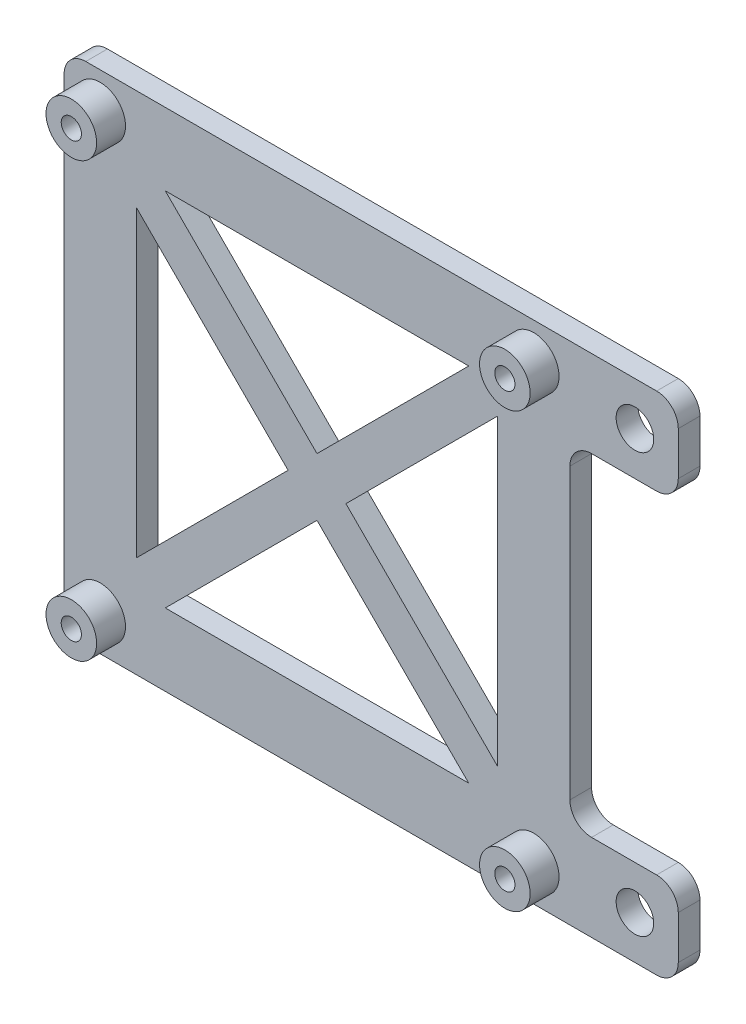
from build123d import *

# Parameters (mm, degrees)
SKETCH1_R           = 2.6
BOSS_EXTRUDE1_DEPTH = 3
SKETCH2_R           = 3.5
BOSS_EXTRUDE2_DEPTH = 4
CUT_EXTRUDE1_DEPTH  = 3
SKETCH4_R           = 1.4
CUT_EXTRUDE2_DEPTH  = 111.335850928


with BuildPart() as part:
    # Sketch1 → Boss-Extrude1 (new body)
    with BuildSketch(Plane.XY):
        with BuildLine():
            Line((3, 0), (70, 0))
            Line((70, 0), (82, 0))
            ThreePointArc((82, 0), (84.121320344, 0.878679656), (85, 3))
            Line((85, 3), (85, 9))
            ThreePointArc((85, 9), (84.121320344, 11.121320344), (82, 12))
            Line((82, 12), (73, 12))
            ThreePointArc((73, 12), (70.878679656, 12.878679656), (70, 15))
            Line((70, 15), (70, 55))
            ThreePointArc((70, 55), (70.878679656, 57.121320344), (73, 58))
            Line((73, 58), (82, 58))
            ThreePointArc((82, 58), (84.121320344, 58.878679656), (85, 61))
            Line((85, 61), (85, 67))
            ThreePointArc((85, 67), (84.121320344, 69.121320344), (82, 70))
            Line((82, 70), (67, 70))
            Line((67, 70), (3, 70))
            ThreePointArc((3, 70), (0.878679656, 69.121320344), (0, 67))
            Line((0, 67), (0, 3))
            ThreePointArc((0, 3), (0.878679656, 0.878679656), (3, 0))
        make_face()
        with Locations((79, 64)):
            Circle(SKETCH1_R, mode=Mode.SUBTRACT)
        with Locations((79, 6)):
            Circle(SKETCH1_R, mode=Mode.SUBTRACT)
    extrude(amount=BOSS_EXTRUDE1_DEPTH)

    # Sketch2 → Boss-Extrude2 (add)
    with BuildSketch(Plane.XY.offset(3)):
        with Locations(Location((5, 65, 0), (0, 0, 180))):
            Circle(SKETCH2_R)
        with Locations(Location((65, 65, 0), (0, 0, 180))):
            Circle(SKETCH2_R)
        with Locations(Location((65, 5, 0), (0, 0, 180))):
            Circle(SKETCH2_R)
        with Locations(Location((5, 5, 0), (0, 0, 180))):
            Circle(SKETCH2_R)
    extrude(amount=BOSS_EXTRUDE2_DEPTH)

    # Sketch3 → Cut-Extrude1 (cut)
    with BuildSketch(Plane.XY.offset(3)):
        Polygon((14, 60), (56, 60), (35, 39), align=None)
        Polygon((60, 56), (60, 14), (39, 35), align=None)
        Polygon((56, 10), (14, 10), (35, 31), align=None)
        Polygon((10, 14), (10, 56), (31, 35), align=None)
    extrude(amount=-CUT_EXTRUDE1_DEPTH, mode=Mode.SUBTRACT)

    # Sketch4 → Cut-Extrude2 (cut, through all)
    with BuildSketch(Plane.XY.offset(7)):
        with Locations((5, 65)):
            Circle(SKETCH4_R)
        with Locations((65, 65)):
            Circle(SKETCH4_R)
        with Locations((65, 5)):
            Circle(SKETCH4_R)
        with Locations((5, 5)):
            Circle(SKETCH4_R)
    extrude(amount=-CUT_EXTRUDE2_DEPTH, mode=Mode.SUBTRACT)


solid = part.part
